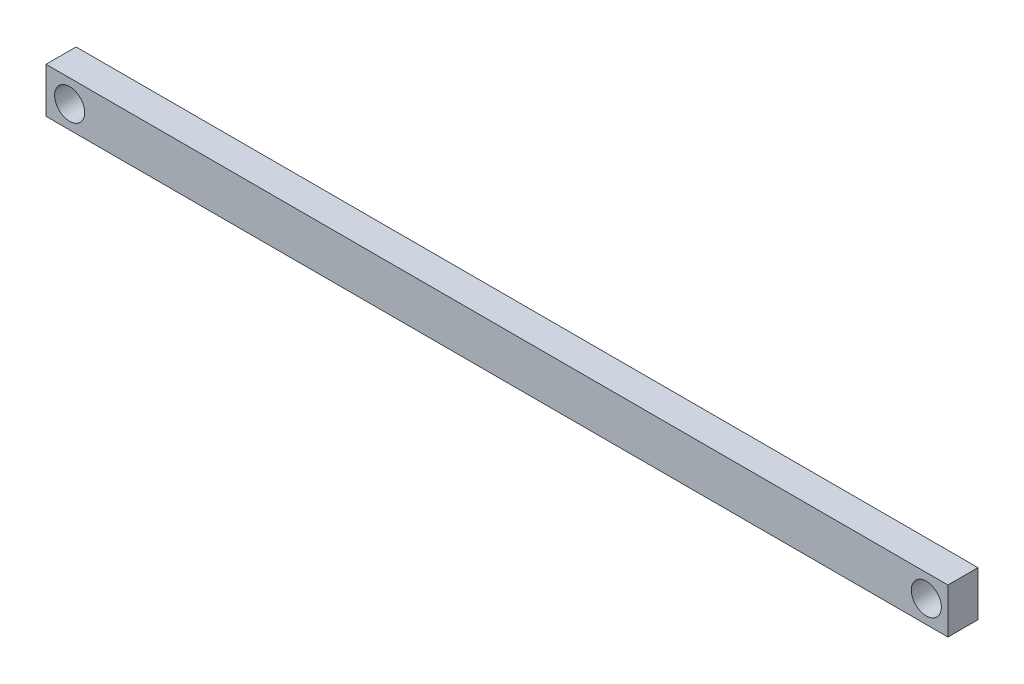
from build123d import *

# Parameters (mm, degrees)
SKETCH_1_W      = 300
SKETCH_1_H      = 15
SKETCH_1_R      = 5
EXTRUDE_1_DEPTH = 10


with BuildPart() as part:
    # 草图1 → 凸台-拉伸1 (new body)
    with BuildSketch(Plane.XY):
        with Locations((91.865286977, 13.872123199)):
            Rectangle(SKETCH_1_W, SKETCH_1_H)
        with Locations((-50.278670722, 13.872123199)):
            Circle(SKETCH_1_R, mode=Mode.SUBTRACT)
        with Locations((234.676155154, 13.872123199)):
            Circle(SKETCH_1_R, mode=Mode.SUBTRACT)
    extrude(amount=EXTRUDE_1_DEPTH)


solid = part.part
